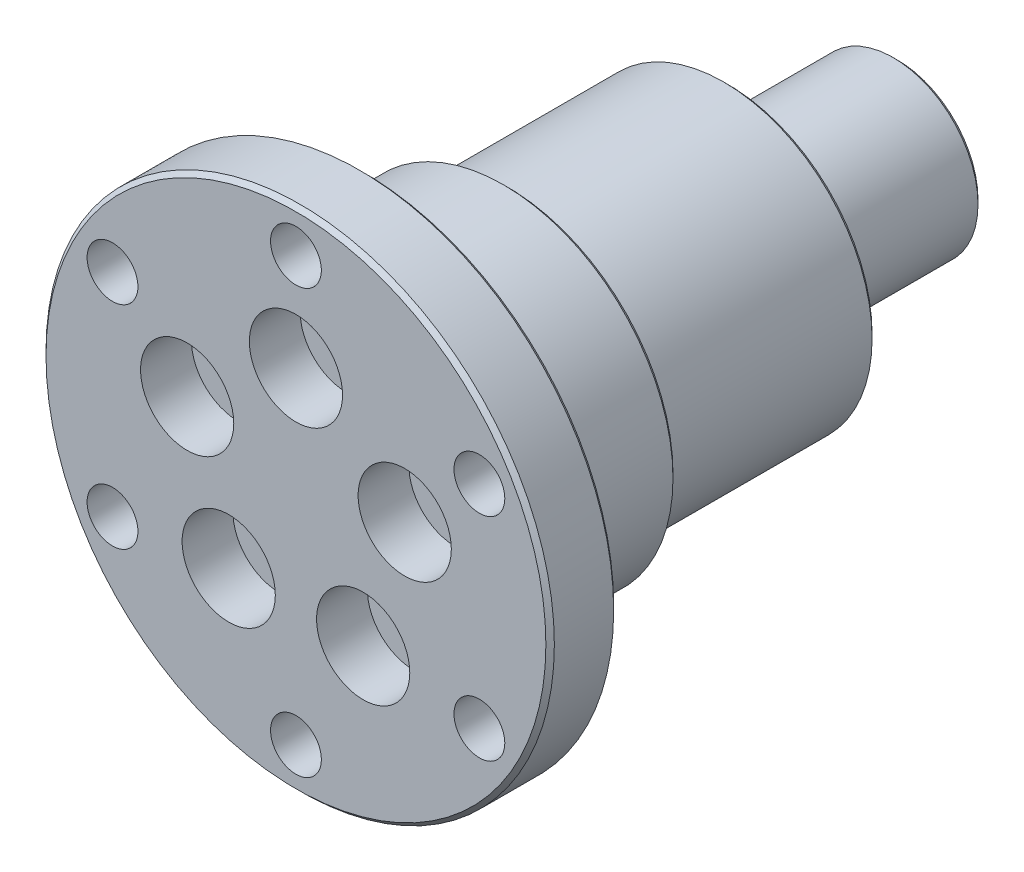
from build123d import *

# Parameters (mm, degrees)
SKETCH_1_R          = 10
EXTRUDE_1_DEPTH     = 20
SKETCH_2_R          = 17.5
EXTRUDE_2_DEPTH     = 41
SKETCH_3_R          = 17.5
EXTRUDE_3_DEPTH     = 10
SKETCH_8_R          = 3
CUT_EXTRUDE_4_DEPTH = 60
EXTRUDE_START       = -8
SKETCH_9_R          = 30
SKETCH_9_R_2        = 17.5
EXTRUDE_4_DEPTH     = 8
EXTRUDE_START_2     = 17
SKETCH_10_R         = 20
SKETCH_10_R_2       = 17.5
EXTRUDE_5_DEPTH     = 17
CHAMFER_1_SIZE      = 0.5
CHAMFER_2_SIZE      = 0.5
SKETCH_12_R         = 5.5
CUT_EXTRUDE_6_DEPTH = 6
SKETCH_13_R         = 3
CUT_EXTRUDE_7_DEPTH = 8


with BuildPart() as part:
    # 草图1 → 拉伸1 (new body)
    with BuildSketch(Plane.XY):
        Circle(SKETCH_1_R)
    extrude(amount=EXTRUDE_1_DEPTH)

    # 草图2 → 拉伸2 (add)
    with BuildSketch(Plane.XY.offset(20)):
        Circle(SKETCH_2_R)
    extrude(amount=EXTRUDE_2_DEPTH)

    # 草图3 → 拉伸3 (add)
    with BuildSketch(Plane.XY.offset(61)):
        Circle(SKETCH_3_R)
    extrude(amount=EXTRUDE_3_DEPTH)

    # 草图8 → 切除-拉伸4 (cut)
    with BuildSketch(Plane.XY.offset(71)):
        with Locations((12.83926297, 4.171729424)):
            Circle(SKETCH_8_R)
        with Locations((0, 13.5)):
            Circle(SKETCH_8_R)
        with Locations((7.935100906, -10.921729424)):
            Circle(SKETCH_8_R)
        with Locations((-7.935100906, -10.921729424)):
            Circle(SKETCH_8_R)
        with Locations((-12.83926297, 4.171729424)):
            Circle(SKETCH_8_R)
    extrude(amount=-CUT_EXTRUDE_4_DEPTH, mode=Mode.SUBTRACT)

    # 草图9 → 拉伸4 (add)
    with BuildSketch(Plane.XY.offset(71).offset(EXTRUDE_START)):
        Circle(SKETCH_9_R)
        Circle(SKETCH_9_R_2, mode=Mode.SUBTRACT)
    extrude(amount=EXTRUDE_4_DEPTH)

    # 草图10 → 拉伸5 (add)
    with BuildSketch(Plane(origin=(0, 0, 63), x_dir=(-1, 0, 0), z_dir=(0, 0, -1)).offset(EXTRUDE_START_2)):
        with Locations(Location((0, 0, 0), (0, 0, 180))):
            Circle(SKETCH_10_R)
        Circle(SKETCH_10_R_2, mode=Mode.SUBTRACT)
    extrude(amount=-EXTRUDE_5_DEPTH)

    # 倒角1
    chamfer_1_edges = [part.edges().sort_by_distance(p)[0] for p in [
        (-17.5, 0, 20),
    ]]
    chamfer(chamfer_1_edges, length=CHAMFER_1_SIZE)

    # 倒角2
    chamfer_2_edges = [part.edges().sort_by_distance(p)[0] for p in [
        (-10, 0, 0),
        (-30, 0, 63),
        (-30, 0, 71),
        (-20, 0, 46),
    ]]
    chamfer(chamfer_2_edges, length=CHAMFER_2_SIZE)

    # 草图12 → 切除-拉伸6 (cut)
    with BuildSketch(Plane.XY.offset(71)):
        with Locations((0, 13.5)):
            Circle(SKETCH_12_R)
        with Locations((12.83926297, 4.171729424)):
            Circle(SKETCH_12_R)
        with Locations((7.935100906, -10.921729424)):
            Circle(SKETCH_12_R)
        with Locations((-7.935100906, -10.921729424)):
            Circle(SKETCH_12_R)
        with Locations((-12.83926297, 4.171729424)):
            Circle(SKETCH_12_R)
    extrude(amount=-CUT_EXTRUDE_6_DEPTH, mode=Mode.SUBTRACT)

    # 草图13 → 切除-拉伸7 (cut)
    with BuildSketch(Plane.XY.offset(71)):
        with Locations((0, 25)):
            Circle(SKETCH_13_R)
        with Locations((21.650635095, 12.5)):
            Circle(SKETCH_13_R)
        with Locations((21.650635095, -12.5)):
            Circle(SKETCH_13_R)
        with Locations((0, -25)):
            Circle(SKETCH_13_R)
        with Locations((-21.650635095, -12.5)):
            Circle(SKETCH_13_R)
        with Locations((-21.650635095, 12.5)):
            Circle(SKETCH_13_R)
    extrude(amount=-CUT_EXTRUDE_7_DEPTH, mode=Mode.SUBTRACT)


solid = part.part
